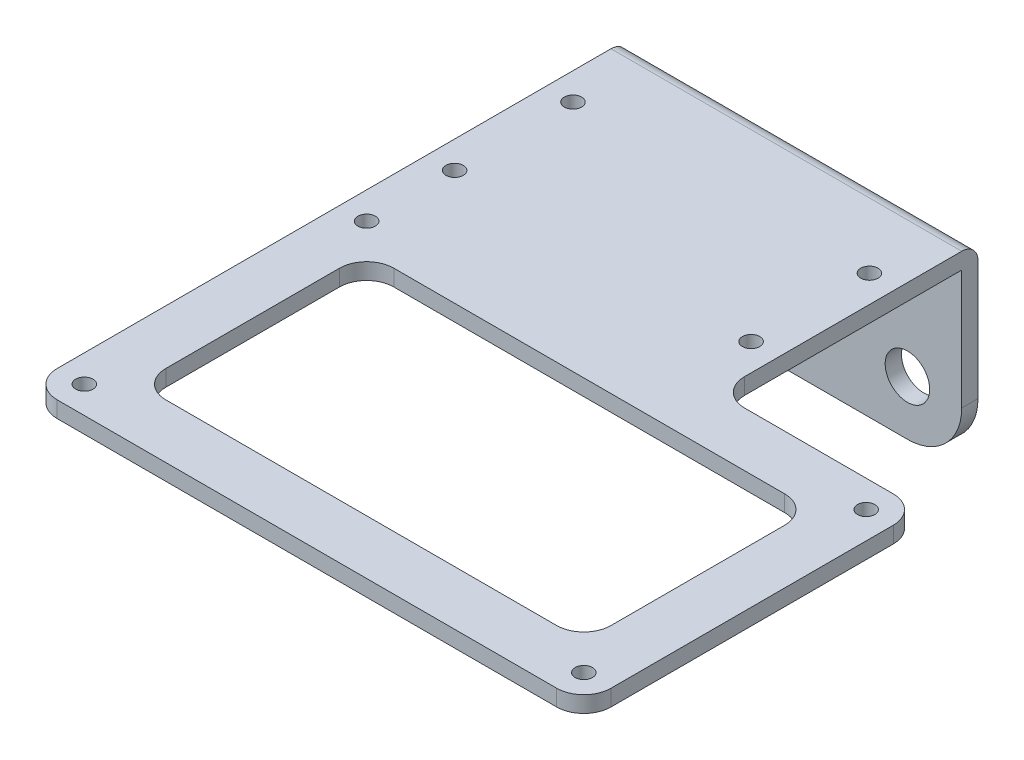
from build123d import *

# Parameters (mm, degrees)
SKETCH_1_W          = 110
SKETCH_1_H          = 110
EXTRUDE_1_DEPTH     = 3
CUT_EXTRUDE_1_REACH = 79.84
SKETCH_2_R          = 1.6
CUT_EXTRUDE_2_REACH = 79.84
SKETCH_5_W          = 64.6
SKETCH_5_H          = 3
EXTRUDE_2_DEPTH     = 32
CUT_EXTRUDE_3_REACH = 129.079
SKETCH_6_R          = 4.1
CUT_EXTRUDE_4_REACH = 87.294
FILLET_1_R          = 5
FILLET_2_R          = 3
FILLET_3_R          = 10


with BuildPart() as part:
    # 草图1 → 凸台-拉伸1 (new body)
    with BuildSketch(Plane(origin=(0, 0, 0), x_dir=(1, 0, 0), z_dir=(0, 1, 0))):
        Rectangle(SKETCH_1_W, SKETCH_1_H)
    extrude(amount=EXTRUDE_1_DEPTH)

    # 草图2 → 切除-拉伸1 (cut, up to next)
    with BuildSketch(Plane(origin=(0, 3, 0), x_dir=(1, 0, 0), z_dir=(0, 1, 0)), mode=Mode.PRIVATE) as cut_extrude_1_sk1:
        with Locations(Location((-50, 40, 0), (0, 0, 270))):
            Circle(SKETCH_2_R)
    cut_extrude_1_tool1 = extrude(cut_extrude_1_sk1.sketch, amount=-CUT_EXTRUDE_1_REACH, mode=Mode.PRIVATE) & part.part
    # 草图2 → 切除-拉伸1 (cut, up to next)
    with BuildSketch(Plane(origin=(0, 3, 0), x_dir=(1, 0, 0), z_dir=(0, 1, 0)), mode=Mode.PRIVATE) as cut_extrude_1_sk2:
        with Locations(Location((4.6, 40, 0), (0, 0, 270))):
            Circle(SKETCH_2_R)
    cut_extrude_1_tool2 = extrude(cut_extrude_1_sk2.sketch, amount=-CUT_EXTRUDE_1_REACH, mode=Mode.PRIVATE) & part.part
    # 草图2 → 切除-拉伸1 (cut, up to next)
    with BuildSketch(Plane(origin=(0, 3, 0), x_dir=(1, 0, 0), z_dir=(0, 1, 0)), mode=Mode.PRIVATE) as cut_extrude_1_sk3:
        with Locations(Location((4.6, 18.2, 0), (0, 0, 270))):
            Circle(SKETCH_2_R)
    cut_extrude_1_tool3 = extrude(cut_extrude_1_sk3.sketch, amount=-CUT_EXTRUDE_1_REACH, mode=Mode.PRIVATE) & part.part
    # 草图2 → 切除-拉伸1 (cut, up to next)
    with BuildSketch(Plane(origin=(0, 3, 0), x_dir=(1, 0, 0), z_dir=(0, 1, 0)), mode=Mode.PRIVATE) as cut_extrude_1_sk4:
        with Locations(Location((-50, 18.2, 0), (0, 0, 270))):
            Circle(SKETCH_2_R)
    cut_extrude_1_tool4 = extrude(cut_extrude_1_sk4.sketch, amount=-CUT_EXTRUDE_1_REACH, mode=Mode.PRIVATE) & part.part
    # 草图2 → 切除-拉伸1 (cut, up to next)
    with BuildSketch(Plane(origin=(0, 3, 0), x_dir=(1, 0, 0), z_dir=(0, 1, 0)), mode=Mode.PRIVATE) as cut_extrude_1_sk5:
        with Locations(Location((-50, -50, 0), (0, 0, 270))):
            Circle(SKETCH_2_R)
    cut_extrude_1_tool5 = extrude(cut_extrude_1_sk5.sketch, amount=-CUT_EXTRUDE_1_REACH, mode=Mode.PRIVATE) & part.part
    # 草图2 → 切除-拉伸1 (cut, up to next)
    with BuildSketch(Plane(origin=(0, 3, 0), x_dir=(1, 0, 0), z_dir=(0, 1, 0)), mode=Mode.PRIVATE) as cut_extrude_1_sk6:
        with Locations(Location((42, -50, 0), (0, 0, 270))):
            Circle(SKETCH_2_R)
    cut_extrude_1_tool6 = extrude(cut_extrude_1_sk6.sketch, amount=-CUT_EXTRUDE_1_REACH, mode=Mode.PRIVATE) & part.part
    # 草图2 → 切除-拉伸1 (cut, up to next)
    with BuildSketch(Plane(origin=(0, 3, 0), x_dir=(1, 0, 0), z_dir=(0, 1, 0)), mode=Mode.PRIVATE) as cut_extrude_1_sk7:
        with Locations(Location((42, 2, 0), (0, 0, 270))):
            Circle(SKETCH_2_R)
    cut_extrude_1_tool7 = extrude(cut_extrude_1_sk7.sketch, amount=-CUT_EXTRUDE_1_REACH, mode=Mode.PRIVATE) & part.part
    # 草图2 → 切除-拉伸1 (cut, up to next)
    with BuildSketch(Plane(origin=(0, 3, 0), x_dir=(1, 0, 0), z_dir=(0, 1, 0)), mode=Mode.PRIVATE) as cut_extrude_1_sk8:
        with Locations(Location((-50, 2, 0), (0, 0, 270))):
            Circle(SKETCH_2_R)
    cut_extrude_1_tool8 = extrude(cut_extrude_1_sk8.sketch, amount=-CUT_EXTRUDE_1_REACH, mode=Mode.PRIVATE) & part.part
    add(cut_extrude_1_tool1.solids().sort_by_distance((-50, 3, -40))[0], mode=Mode.SUBTRACT)
    add(cut_extrude_1_tool2.solids().sort_by_distance((4.6, 3, -40))[0], mode=Mode.SUBTRACT)
    add(cut_extrude_1_tool3.solids().sort_by_distance((4.6, 3, -18.2))[0], mode=Mode.SUBTRACT)
    add(cut_extrude_1_tool4.solids().sort_by_distance((-50, 3, -18.2))[0], mode=Mode.SUBTRACT)
    add(cut_extrude_1_tool5.solids().sort_by_distance((-50, 3, 50))[0], mode=Mode.SUBTRACT)
    add(cut_extrude_1_tool6.solids().sort_by_distance((42, 3, 50))[0], mode=Mode.SUBTRACT)
    add(cut_extrude_1_tool7.solids().sort_by_distance((42, 3, -2))[0], mode=Mode.SUBTRACT)
    add(cut_extrude_1_tool8.solids().sort_by_distance((-50, 3, -2))[0], mode=Mode.SUBTRACT)

    # 草图3 → 切除-拉伸2 (cut, up to next)
    with BuildSketch(Plane(origin=(0, 3, 0), x_dir=(1, 0, 0), z_dir=(0, 1, 0)), mode=Mode.PRIVATE) as cut_extrude_2_sk1:
        Polygon((55, 17), (55, -55), (47, -55), (47, 7), (9.6, 7), (9.6, 55), (55, 55), align=None)
    cut_extrude_2_tool1 = extrude(cut_extrude_2_sk1.sketch, amount=-CUT_EXTRUDE_2_REACH, mode=Mode.PRIVATE) & part.part
    add(cut_extrude_2_tool1.solids().sort_by_distance((35.767105, 3, -20.802632))[0], mode=Mode.SUBTRACT)

    # 草图5 → 凸台-拉伸2 (add)
    with BuildSketch(Plane.XZ):
        with Locations((-22.7, -53.5)):
            Rectangle(SKETCH_5_W, SKETCH_5_H)
    extrude(amount=EXTRUDE_2_DEPTH)

    # 草图6 → 切除-拉伸3 (cut, up to next)
    with BuildSketch(Plane(origin=(0, 0, -55), x_dir=(-1, 0, 0), z_dir=(0, 0, -1)), mode=Mode.PRIVATE) as cut_extrude_3_sk1:
        with Locations((0.4, -22)):
            Circle(SKETCH_6_R)
    cut_extrude_3_tool1 = extrude(cut_extrude_3_sk1.sketch, amount=-CUT_EXTRUDE_3_REACH, mode=Mode.PRIVATE) & part.part
    # 草图6 → 切除-拉伸3 (cut, up to next)
    with BuildSketch(Plane(origin=(0, 0, -55), x_dir=(-1, 0, 0), z_dir=(0, 0, -1)), mode=Mode.PRIVATE) as cut_extrude_3_sk2:
        with Locations((45, -22)):
            Circle(SKETCH_6_R)
    cut_extrude_3_tool2 = extrude(cut_extrude_3_sk2.sketch, amount=-CUT_EXTRUDE_3_REACH, mode=Mode.PRIVATE) & part.part
    add(cut_extrude_3_tool1.solids().sort_by_distance((-0.4, -22, -55))[0], mode=Mode.SUBTRACT)
    add(cut_extrude_3_tool2.solids().sort_by_distance((-45, -22, -55))[0], mode=Mode.SUBTRACT)

    # 草图7 → 切除-拉伸4 (cut, up to next)
    with BuildSketch(Plane(origin=(0, 3, 0), x_dir=(1, 0, 0), z_dir=(0, 1, 0)), mode=Mode.PRIVATE) as cut_extrude_4_sk1:
        with BuildLine():
            Line((-40, -3), (32, -3))
            ThreePointArc((32, -3), (35.535533906, -4.464466094), (37, -8))
            Line((37, -8), (37, -40))
            ThreePointArc((37, -40), (35.535533906, -43.535533906), (32, -45))
            Line((32, -45), (-40, -45))
            ThreePointArc((-40, -45), (-43.535533906, -43.535533906), (-45, -40))
            Line((-45, -40), (-45, -8))
            ThreePointArc((-45, -8), (-43.535533906, -4.464466094), (-40, -3))
        make_face()
    cut_extrude_4_tool1 = extrude(cut_extrude_4_sk1.sketch, amount=-CUT_EXTRUDE_4_REACH, mode=Mode.PRIVATE) & part.part
    add(cut_extrude_4_tool1.solids().sort_by_distance((-4, 3, 24))[0], mode=Mode.SUBTRACT)

    # 圆角1
    fillet_1_edges = [part.edges().sort_by_distance(p)[0] for p in [
        (47, 1.5, 55),
        (47, 1.5, -7),
        (9.6, 1.5, -7),
        (-55, 1.5, 55),
    ]]
    fillet(fillet_1_edges, radius=FILLET_1_R)

    # 圆角2
    fillet_2_edges = [part.edges().sort_by_distance(p)[0] for p in [
        (-22.7, 3, -55),
    ]]
    fillet(fillet_2_edges, radius=FILLET_2_R)

    # 圆角3
    fillet_3_edges = [part.edges().sort_by_distance(p)[0] for p in [
        (9.6, -32, -53.5),
        (-55, -32, -53.5),
    ]]
    fillet(fillet_3_edges, radius=FILLET_3_R)


solid = part.part
